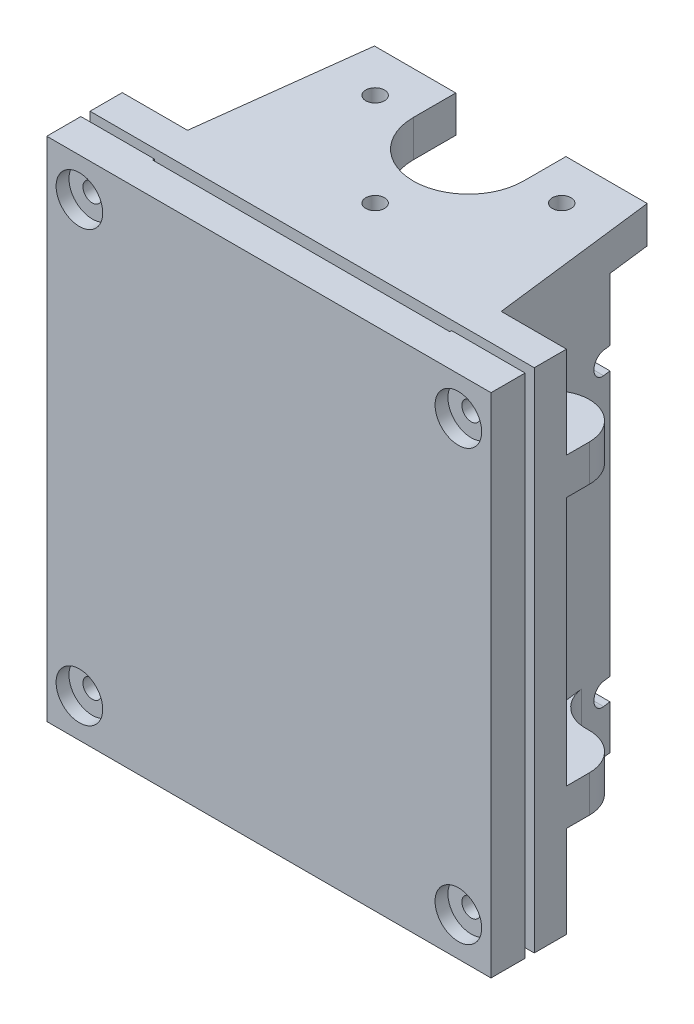
from build123d import *

# Parameters (mm, degrees)
BOSS_EXTRUDE1_DEPTH             = 56.515
BOSS_EXTRUDE2_DEPTH             = 15
SKETCH5_R                       = 2.5527
BOSS_EXTRUDE3_DEPTH             = 10
CUT_EXTRUDE1_START              = -3.175
CUT_EXTRUDE1_DEPTH              = 3.175
CUT_EXTRUDE2_REACH              = 106.056
SKETCH9_R                       = 2.5527
BOSS_EXTRUDE4_REACH             = 104.878
SKETCH1_3_W                     = 120.969439872
SKETCH1_3_H                     = 8.778360828
BOSS_EXTRUDE4_DIRECTION_2_REACH = 104.878
SKETCH10_R                      = 6.35
CUT_EXTRUDE3_DEPTH              = 3.506722
SKETCH11_W                      = 20
SKETCH11_H                      = 0.5
BOSS_EXTRUDE5_DEPTH             = 138.03
CUT_EXTRUDE4_DEPTH              = 105.056451094
CUT_EXTRUDE4_DEPTH_BACK         = 105.056451094
SKETCH9_2_R                     = 2.5527
SKETCH13_R                      = 2
BOSS_EXTRUDE6_DEPTH             = 10
FILLET2_R                       = 10
CUT_EXTRUDE5_DEPTH              = 109.282730577
FILLET4_R                       = 10
MIRROR2_COPY_1_SKETCH_R         = 2
MIRROR2_COPY_1_DEPTH            = 10
FILLET4_OF_MIRROR2_R            = 10


with BuildPart() as part:
    # Sketch1 → Boss-Extrude1 (new, symmetric)
    with BuildSketch(Plane(origin=(0, 0, 0), x_dir=(1, 0, 0), z_dir=(0, 1, 0))):
        with BuildLine():
            Line((-32.5572, 0), (-38.5572, 0))
            Line((-38.5572, 0), (-42.704719936, -33.778839172))
            Line((-42.704719936, -33.778839172), (-60.484719936, -33.778839172))
            Line((-60.484719936, -33.778839172), (-60.484719936, -42.5572))
            Line((-60.484719936, -42.5572), (60.484719936, -42.5572))
            Line((60.484719936, -42.5572), (60.484719936, -33.778839172))
            Line((60.484719936, -33.778839172), (42.704719936, -33.778839172))
            Line((42.704719936, -33.778839172), (38.5572, 0))
            Line((38.5572, 0), (32.5572, 0))
            ThreePointArc((32.5572, 0), (0, -32.5572), (-32.5572, 0))
        make_face()
    extrude(amount=BOSS_EXTRUDE1_DEPTH, both=True)

    # Sketch4 → Boss-Extrude2 (add)
    with BuildSketch(Plane.XZ.offset(56.515)):
        with BuildLine():
            Line((60.484719936, 42.5572), (-60.484719936, 42.5572))
            Line((-60.484719936, 42.5572), (-60.484719936, 33.778839172))
            Line((-60.484719936, 33.778839172), (-42.704719936, 33.778839172))
            Line((-42.704719936, 33.778839172), (-40.398968414, 15))
            Line((-40.398968414, 15), (-13.228756555, 15))
            ThreePointArc((-13.228756555, 15), (0, 20), (13.228756555, 15))
            Line((13.228756555, 15), (40.398968414, 15))
            Line((40.398968414, 15), (42.704719936, 33.778839172))
            Line((42.704719936, 33.778839172), (60.484719936, 33.778839172))
            Line((60.484719936, 33.778839172), (60.484719936, 42.5572))
        make_face()
    extrude(amount=BOSS_EXTRUDE2_DEPTH)

    # Sketch5 → Boss-Extrude3 (add)
    with BuildSketch(Plane(origin=(0, 56.515, 0), x_dir=(1, 0, 0), z_dir=(0, 1, 0))):
        with BuildLine():
            Line((-42.704719936, -33.778839172), (-37.138706803, 11.5527))
            Line((-37.138706803, 11.5527), (-15, 11.5527))
            Line((-15, 11.5527), (-15, 0))
            ThreePointArc((-15, 0), (0, -15), (15, 0))
            Line((15, 0), (15, 11.5527))
            Line((15, 11.5527), (37.138706803, 11.5527))
            Line((37.138706803, 11.5527), (42.704719936, -33.778839172))
            Line((42.704719936, -33.778839172), (60.484719936, -33.778839172))
            Line((60.484719936, -33.778839172), (60.484719936, -42.5572))
            Line((60.484719936, -42.5572), (-60.484719936, -42.5572))
            Line((-60.484719936, -42.5572), (-60.484719936, -33.778839172))
            Line((-60.484719936, -33.778839172), (-42.704719936, -33.778839172))
        make_face()
        with Locations(Location((0, -25.4, 0), (0, 0, 270))):
            Circle(SKETCH5_R, mode=Mode.SUBTRACT)
        with Locations(Location((25.4, 0, 0), (0, 0, 270))):
            Circle(SKETCH5_R, mode=Mode.SUBTRACT)
        with Locations(Location((-25.4, 0, 0), (0, 0, 270))):
            Circle(SKETCH5_R, mode=Mode.SUBTRACT)
    extrude(amount=BOSS_EXTRUDE3_DEPTH)

    # Sketch7 → Cut-Extrude1 (cut)
    with BuildSketch(Plane(origin=(0, 0, 33.778839172), x_dir=(-1, 0, 0), z_dir=(0, 0, -1)).offset(CUT_EXTRUDE1_START)):
        Polygon((51.594719936, -55.516477372), (46.832219936, -58.266108029), (46.832219936, -63.765369343), (51.594719936, -66.515), (56.357219936, -63.765369343), (56.357219936, -58.266108029), align=None)
        Polygon((46.832219936, 53.266108029), (51.594719936, 50.516477372), (56.357219936, 53.266108029), (56.357219936, 58.765369343), (51.594719936, 61.515), (46.832219936, 58.765369343), align=None)
        Polygon((-46.832219936, -58.266108029), (-51.594719936, -55.516477372), (-56.357219936, -58.266108029), (-56.357219936, -63.765369343), (-51.594719936, -66.515), (-46.832219936, -63.765369343), align=None)
        Polygon((-51.594719936, 50.516477372), (-46.832219936, 53.266108029), (-46.832219936, 58.765369343), (-51.594719936, 61.515), (-56.357219936, 58.765369343), (-56.357219936, 53.266108029), align=None)
    extrude(amount=CUT_EXTRUDE1_DEPTH, mode=Mode.SUBTRACT)

    # Sketch9 → Cut-Extrude2 (cut, up to next)
    with BuildSketch(Plane(origin=(0, 0, 33.778839172), x_dir=(-1, 0, 0), z_dir=(0, 0, -1)), mode=Mode.PRIVATE) as cut_extrude2_sk1:
        with Locations((51.594719936, 56.015738686)):
            Circle(SKETCH9_R)
    cut_extrude2_tool1 = extrude(cut_extrude2_sk1.sketch, amount=-CUT_EXTRUDE2_REACH, mode=Mode.PRIVATE) & part.part
    # Sketch9 → Cut-Extrude2 (cut, up to next)
    with BuildSketch(Plane(origin=(0, 0, 33.778839172), x_dir=(-1, 0, 0), z_dir=(0, 0, -1)), mode=Mode.PRIVATE) as cut_extrude2_sk2:
        with Locations((51.594719936, -61.015738686)):
            Circle(SKETCH9_R)
    cut_extrude2_tool2 = extrude(cut_extrude2_sk2.sketch, amount=-CUT_EXTRUDE2_REACH, mode=Mode.PRIVATE) & part.part
    # Sketch9 → Cut-Extrude2 (cut, up to next)
    with BuildSketch(Plane(origin=(0, 0, 33.778839172), x_dir=(-1, 0, 0), z_dir=(0, 0, -1)), mode=Mode.PRIVATE) as cut_extrude2_sk3:
        with Locations((-51.594719936, -61.015738686)):
            Circle(SKETCH9_R)
    cut_extrude2_tool3 = extrude(cut_extrude2_sk3.sketch, amount=-CUT_EXTRUDE2_REACH, mode=Mode.PRIVATE) & part.part
    # Sketch9 → Cut-Extrude2 (cut, up to next)
    with BuildSketch(Plane(origin=(0, 0, 33.778839172), x_dir=(-1, 0, 0), z_dir=(0, 0, -1)), mode=Mode.PRIVATE) as cut_extrude2_sk4:
        with Locations((-51.594719936, 56.015738686)):
            Circle(SKETCH9_R)
    cut_extrude2_tool4 = extrude(cut_extrude2_sk4.sketch, amount=-CUT_EXTRUDE2_REACH, mode=Mode.PRIVATE) & part.part
    add(cut_extrude2_tool1.solids().sort_by_distance((-51.59472, 56.015739, 33.778839))[0], mode=Mode.SUBTRACT)
    add(cut_extrude2_tool2.solids().sort_by_distance((-51.59472, -61.015739, 33.778839))[0], mode=Mode.SUBTRACT)
    add(cut_extrude2_tool3.solids().sort_by_distance((51.59472, -61.015739, 33.778839))[0], mode=Mode.SUBTRACT)
    add(cut_extrude2_tool4.solids().sort_by_distance((51.59472, 56.015739, 33.778839))[0], mode=Mode.SUBTRACT)


with BuildPart() as body_2:

    # Boss-Extrude4: up to this face of the body (flat: up to its plane)
    boss_extrude4_end = Plane(part.part.faces().sort_by_distance((0, 66.515, 20.891367275))[0])
    # Sketch1<3> → Boss-Extrude4 (new, up to the picked face)
    with BuildSketch(Plane(origin=(0, 0, 0), x_dir=(1, 0, 0), z_dir=(0, 1, 0)), mode=Mode.PRIVATE) as boss_extrude4_sk1:
        with Locations((0, -49.946380414)):
            Rectangle(SKETCH1_3_W, SKETCH1_3_H)
    boss_extrude4_tool1 = split(extrude(boss_extrude4_sk1.sketch, amount=BOSS_EXTRUDE4_REACH, mode=Mode.PRIVATE), bisect_by=boss_extrude4_end, keep=Keep.BOTH, mode=Mode.PRIVATE)
    add(boss_extrude4_tool1.solids().sort_by(Axis((0, 0, 49.94638), (0, 1, 0)))[0])


    # Boss-Extrude4 direction 2: up to this face of the body (flat: up to its plane)
    boss_extrude4_direction_2_end = Plane(part.part.faces().sort_by_distance((0, -71.515, 30.485789966))[0])
    # Sketch1<3> → Boss-Extrude4 direction 2 (add, up to the picked face)
    with BuildSketch(Plane(origin=(0, 0, 0), x_dir=(1, 0, 0), z_dir=(0, 1, 0)), mode=Mode.PRIVATE) as boss_extrude4_direction_2_sk1:
        with Locations((0, -49.946380414)):
            Rectangle(SKETCH1_3_W, SKETCH1_3_H)
    boss_extrude4_direction_2_tool1 = split(extrude(boss_extrude4_direction_2_sk1.sketch, amount=-BOSS_EXTRUDE4_DIRECTION_2_REACH, mode=Mode.PRIVATE), bisect_by=boss_extrude4_direction_2_end, keep=Keep.BOTH, mode=Mode.PRIVATE)
    add(boss_extrude4_direction_2_tool1.solids().sort_by(Axis((0, 0, 49.94638), (0, -1, 0)))[0])

    # Sketch10 → Cut-Extrude3 (cut)
    with BuildSketch(Plane.XY.offset(54.335560828)):
        with Locations((-51.594719936, 56.015738686)):
            Circle(SKETCH10_R)
        with Locations((51.594719936, 56.015738686)):
            Circle(SKETCH10_R)
        with Locations((51.594719936, -61.015738686)):
            Circle(SKETCH10_R)
        with Locations((-51.594719936, -61.015738686)):
            Circle(SKETCH10_R)
    extrude(amount=-CUT_EXTRUDE3_DEPTH, mode=Mode.SUBTRACT)

    # Sketch11 → Boss-Extrude5 (add)
    with BuildSketch(Plane(origin=(0, 66.515, 0), x_dir=(1, 0, 0), z_dir=(0, 1, 0))):
        with Locations((-50.484719936, -45.3072)):
            Rectangle(SKETCH11_W, SKETCH11_H)
        with Locations((50.484719936, -45.3072)):
            Rectangle(SKETCH11_W, SKETCH11_H)
    extrude(amount=-BOSS_EXTRUDE5_DEPTH)

    # Sketch9<2> → Cut-Extrude4 (cut, two sides: drawn at the far end of the back side and taken through both)
    with BuildSketch(Plane(origin=(0, 0, 33.778839172), x_dir=(-1, 0, 0), z_dir=(0, 0, -1)).offset(-CUT_EXTRUDE4_DEPTH_BACK)):
        with Locations((51.594719936, 56.015738686)):
            Circle(SKETCH9_2_R)
        with Locations((51.594719936, -61.015738686)):
            Circle(SKETCH9_2_R)
        with Locations((-51.594719936, -61.015738686)):
            Circle(SKETCH9_2_R)
        with Locations((-51.594719936, 56.015738686)):
            Circle(SKETCH9_2_R)
    extrude(amount=CUT_EXTRUDE4_DEPTH + CUT_EXTRUDE4_DEPTH_BACK, mode=Mode.SUBTRACT)


with BuildPart() as part_1:
    add(part.part)

    # Sketch13 → Boss-Extrude6 (add)
    with BuildSketch(Plane(origin=(0, -36.515, 0), x_dir=(-1, 0, 0), z_dir=(0, -1, 0))):
        with BuildLine():
            Line((-60.484719936, -27.5572), (-60.484719936, -42.5572))
            Line((-60.484719936, -42.5572), (-40.484719936, -42.5572))
            Line((-40.484719936, -42.5572), (-40.484719936, -27.5572))
            ThreePointArc((-40.484719936, -27.5572), (-50.484719936, -17.5572), (-60.484719936, -27.5572))
        make_face()
        with Locations(Location((-50.484719936, -27.5572, 0), (0, 0, 90))):
            Circle(SKETCH13_R, mode=Mode.SUBTRACT)
    boss_extrude6 = extrude(amount=BOSS_EXTRUDE6_DEPTH)

    # Fillet2
    fillet2_edges = [part_1.edges().sort_by_distance(p)[0] for p in [
        (41.421837316, -41.515, 23.330598691),
    ]]
    fillet(fillet2_edges, radius=FILLET2_R)

    # Sketch15 → Cut-Extrude5 (cut, symmetric)
    with BuildSketch(Plane(origin=(0, 0, 0), x_dir=(0, 0, -1), z_dir=(1, 0, 0))):
        with BuildLine():
            Line((-2, -38.515), (0, -38.515))
            ThreePointArc((0, -38.515), (3, -41.515), (0, -44.515))
            Line((0, -44.515), (-2, -44.515))
            ThreePointArc((-2, -44.515), (-5, -41.515), (-2, -38.515))
        make_face()
    cut_extrude5 = extrude(amount=CUT_EXTRUDE5_DEPTH, both=True, mode=Mode.SUBTRACT)

    # Mirror1: Boss-Extrude6 across plane
    add(boss_extrude6.mirror(Plane(origin=(0, 0, 0), x_dir=(0, 0, 1), z_dir=(1, 0, 0))))

    # Fillet4
    fillet4_edges = [part_1.edges().sort_by_distance(p)[0] for p in [
        (-41.421837316, -41.515, 23.330598691),
    ]]
    fillet(fillet4_edges, radius=FILLET4_R)

    # Mirror2: Boss-Extrude6, Cut-Extrude5 across plane
    add(boss_extrude6.mirror(Plane(origin=(0, -2.5, 0), x_dir=(0, 0, 1), z_dir=(0, -1, 0))))
    add(cut_extrude5.mirror(Plane(origin=(0, -2.5, 0), x_dir=(0, 0, 1), z_dir=(0, -1, 0))), mode=Mode.SUBTRACT)

    # Mirror2 copy 1 sketch → Mirror2 copy 1 (add)
    with BuildSketch(Plane(origin=(0, 31.515, 0), x_dir=(1, 0, 0), z_dir=(0, 1, 0))):
        with BuildLine():
            Line((-60.484719936, -27.5572), (-60.484719936, -42.5572))
            Line((-60.484719936, -42.5572), (-40.484719936, -42.5572))
            Line((-40.484719936, -42.5572), (-40.484719936, -27.5572))
            ThreePointArc((-40.484719936, -27.5572), (-50.484719936, -17.5572), (-60.484719936, -27.5572))
        make_face()
        with Locations(Location((-50.484719936, -27.5572, 0), (0, 0, 90))):
            Circle(MIRROR2_COPY_1_SKETCH_R, mode=Mode.SUBTRACT)
    extrude(amount=MIRROR2_COPY_1_DEPTH)

    # Fillet4 of Mirror2
    fillet4_of_mirror2_edges = [part_1.edges().sort_by_distance(p)[0] for p in [
        (-41.421837316, 36.515, 23.330598691),
    ]]
    fillet(fillet4_of_mirror2_edges, radius=FILLET4_OF_MIRROR2_R)


solid = Compound([body_2.part, part_1.part])
